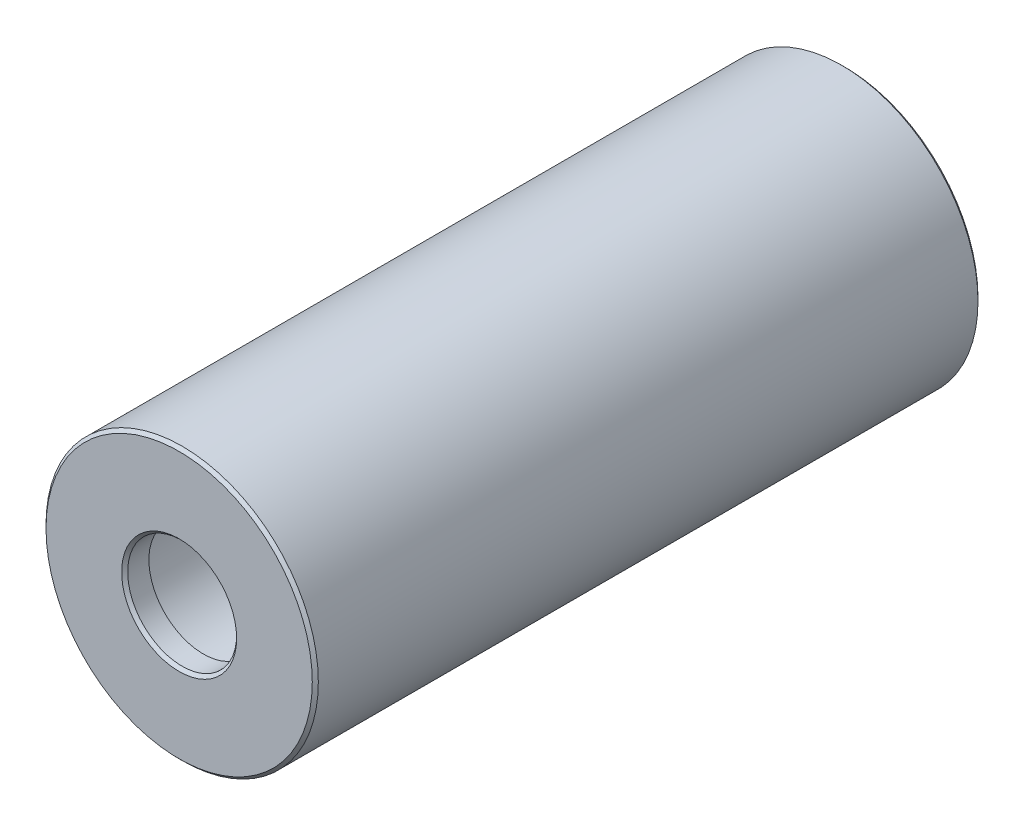
from build123d import *

# Parameters (mm, degrees)
CHAMFER1_SIZE = 0.5


with BuildPart() as part:
    # Sketch1 → Revolve1 (revolve)
    with BuildSketch(Plane(origin=(0, 0, 0), x_dir=(0, 0, -1), z_dir=(1, 0, 0)), mode=Mode.PRIVATE) as revolve1_sk:
        Polygon((0, 9.5), (0, 22.5), (110, 22.5), (110, 17.5), (109.5, 17), (64, 17), (64, 12.5), (63.5, 12), (4, 12), (4, 9), (0.5, 9), align=None)
    revolve(revolve1_sk.sketch.rotate(Axis((0, 0, 0), (0, 0, -1)), 90), axis=Axis((0, 0, 0), (0, 0, -1)))

    # Chamfer1
    chamfer1_edges = [part.edges().sort_by_distance(p)[0] for p in [
        (-22.5, 0, -110),
        (-22.5, 0, 0),
    ]]
    chamfer(chamfer1_edges, length=CHAMFER1_SIZE)


solid = part.part
